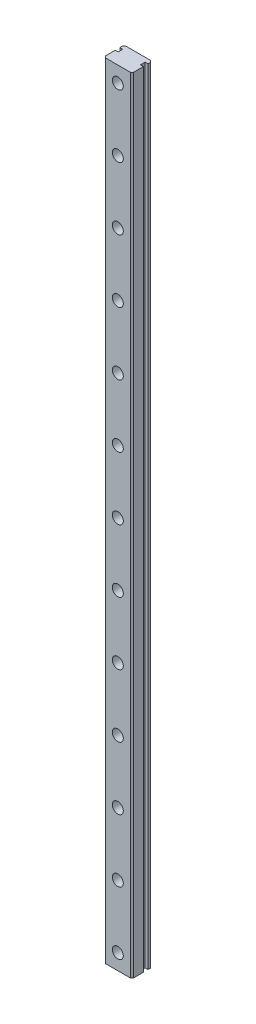
from build123d import *

# Parameters (mm, degrees)
EXTRUDE_1_DEPTH          = 125
EXTRUDE_1_DEPTH_BACK     = 125
SKETCH_1_W               = 9
SKETCH_1_H               = 6.5
CUT_EXTRUDE_1_DEPTH      = 125
CUT_EXTRUDE_1_DEPTH_BACK = 125
SKETCH_2_W               = 0.95
SKETCH_2_H               = 1.48
CHAMFER_2_SIZE           = 0.5
SKETCH_3_R               = 3
CUT_EXTRUDE_2_DEPTH      = 3.5
SKETCH_4_R               = 1.75
CUT_EXTRUDE_3_DEPTH      = 5


with BuildPart() as part:
    # 草图1 → 凸台-拉伸1 (new, two sides: drawn at the far end of the back side and taken through both)
    with BuildSketch(Plane(origin=(0, 0, 0), x_dir=(1, 0, 0), z_dir=(0, 1, 0)).offset(-EXTRUDE_1_DEPTH_BACK)):
        Rectangle(SKETCH_1_W, SKETCH_1_H)
    extrude(amount=EXTRUDE_1_DEPTH + EXTRUDE_1_DEPTH_BACK)

    # 草图2 → 切除-拉伸1 (cut, two sides: drawn at the far end of the back side and taken through both)
    with BuildSketch(Plane(origin=(0, 0, 0), x_dir=(1, 0, 0), z_dir=(0, 1, 0)).offset(-CUT_EXTRUDE_1_DEPTH_BACK)):
        with Locations((4.025, 1.15)):
            Rectangle(SKETCH_2_W, SKETCH_2_H)
        with Locations((-4.025, 1.15)):
            Rectangle(SKETCH_2_W, SKETCH_2_H)
    extrude(amount=CUT_EXTRUDE_1_DEPTH + CUT_EXTRUDE_1_DEPTH_BACK, mode=Mode.SUBTRACT)

    # 倒角2
    chamfer_2_edges = [part.edges().sort_by_distance(p)[0] for p in [
        (-4.5, 0, 3.25),
        (4.5, 0, 3.25),
        (4.5, 0, -3.25),
        (-4.5, 0, -3.25),
    ]]
    chamfer(chamfer_2_edges, length=CHAMFER_2_SIZE)

    # 草图3 → 切除-拉伸2 (cut)
    with BuildSketch(Plane(origin=(0, 0, -3.25), x_dir=(-1, 0, 0), z_dir=(0, 0, -1))):
        with Locations((0, -120)):
            Circle(SKETCH_3_R)
        with Locations((0, -100)):
            Circle(SKETCH_3_R)
        with Locations((0, -80)):
            Circle(SKETCH_3_R)
        with Locations((0, -60)):
            Circle(SKETCH_3_R)
        with Locations((0, -40)):
            Circle(SKETCH_3_R)
        with Locations((0, -20)):
            Circle(SKETCH_3_R)
        Circle(SKETCH_3_R)
        with Locations((0, 20)):
            Circle(SKETCH_3_R)
        with Locations((0, 40)):
            Circle(SKETCH_3_R)
        with Locations((0, 60)):
            Circle(SKETCH_3_R)
        with Locations((0, 80)):
            Circle(SKETCH_3_R)
        with Locations((0, 100)):
            Circle(SKETCH_3_R)
        with Locations((0, 120)):
            Circle(SKETCH_3_R)
    extrude(amount=-CUT_EXTRUDE_2_DEPTH, mode=Mode.SUBTRACT)

    # 草图4 → 切除-拉伸3 (cut)
    with BuildSketch(Plane(origin=(0, 0, 0.25), x_dir=(-1, 0, 0), z_dir=(0, 0, -1))):
        with Locations((0, -120)):
            Circle(SKETCH_4_R)
        with Locations((0, -100)):
            Circle(SKETCH_4_R)
        with Locations((0, -80)):
            Circle(SKETCH_4_R)
        with Locations((0, -60)):
            Circle(SKETCH_4_R)
        with Locations((0, -40)):
            Circle(SKETCH_4_R)
        with Locations((0, -20)):
            Circle(SKETCH_4_R)
        Circle(SKETCH_4_R)
        with Locations((0, 20)):
            Circle(SKETCH_4_R)
        with Locations((0, 40)):
            Circle(SKETCH_4_R)
        with Locations((0, 60)):
            Circle(SKETCH_4_R)
        with Locations((0, 80)):
            Circle(SKETCH_4_R)
        with Locations((0, 100)):
            Circle(SKETCH_4_R)
        with Locations((0, 120)):
            Circle(SKETCH_4_R)
        with Locations((0, 140)):
            Circle(SKETCH_4_R)
        with Locations((0, 160)):
            Circle(SKETCH_4_R)
    extrude(amount=-CUT_EXTRUDE_3_DEPTH, mode=Mode.SUBTRACT)


solid = part.part
